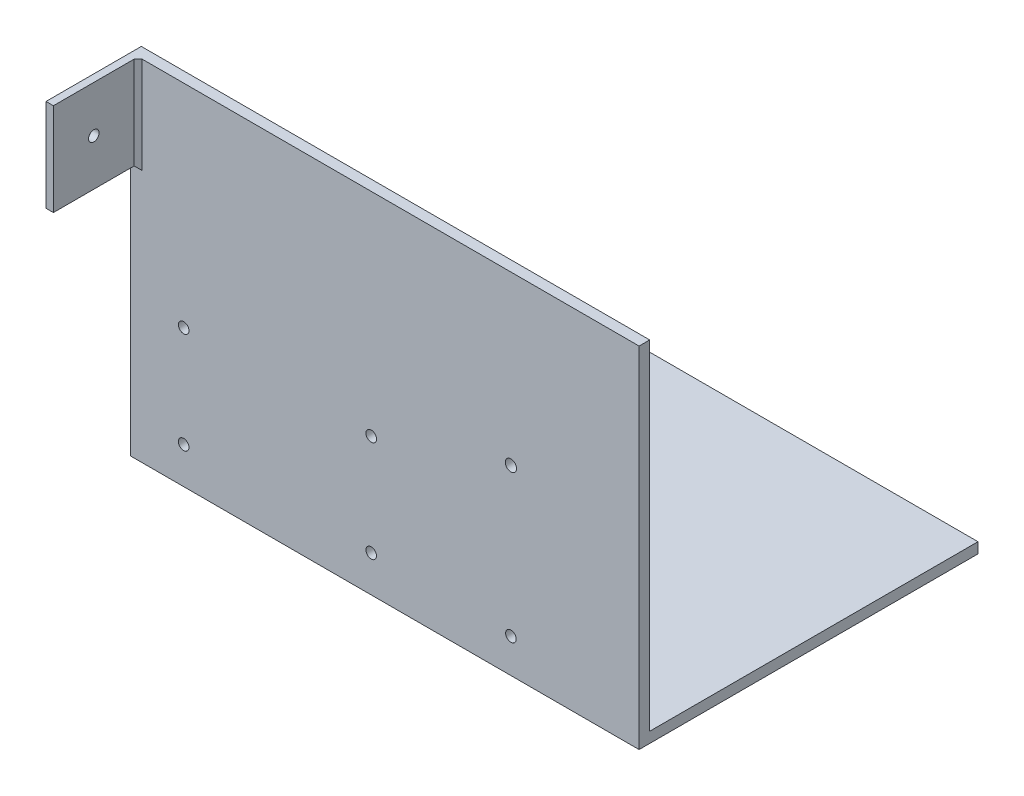
from build123d import *

# Parameters (mm, degrees)
SKETCH1_W           = 304.8
SKETCH1_H           = 203.2
BOSS_EXTRUDE1_DEPTH = 6.35
SKETCH2_W           = 304.8
SKETCH2_H           = 6.35
BOSS_EXTRUDE2_DEPTH = 40.64
SKETCH3_W           = 20.403275231
SKETCH3_H           = 40.64
CUT_EXTRUDE1_DEPTH  = 325.70549749
SKETCH2_2_W         = 304.8
SKETCH2_2_H         = 6.35
BOSS_EXTRUDE3_DEPTH = 203.2
SKETCH9_R           = 3.175
CUT_EXTRUDE2_DEPTH  = 10.922
SKETCH10_R          = 3.175
SKETCH10_R_2        = 3.392842108
CUT_EXTRUDE3_DEPTH  = 10.922
SKETCH11_W          = 4.440800547
SKETCH11_H          = 55.485459727
BOSS_EXTRUDE7_DEPTH = 50.8
CHAMFER1_SIZE       = 2.38
SKETCH12_W          = 5.089607789
SKETCH12_H          = 51.20183316
BOSS_EXTRUDE8_DEPTH = 50.8
CHAMFER2_SIZE       = 2.38
SKETCH13_R          = 3.175
CUT_EXTRUDE4_DEPTH  = 50.8
SKETCH14_R          = 3.175
CUT_EXTRUDE5_DEPTH  = 50.8


with BuildPart() as part:
    # Sketch1 → Boss-Extrude1 (new body)
    with BuildSketch(Plane(origin=(0, 0, 0), x_dir=(1, 0, 0), z_dir=(0, 1, 0))):
        Rectangle(SKETCH1_W, SKETCH1_H)
    extrude(amount=BOSS_EXTRUDE1_DEPTH)

    # Sketch2 → Boss-Extrude2 (add)
    with BuildSketch(Plane(origin=(0, 6.35, 0), x_dir=(1, 0, 0), z_dir=(0, 1, 0))):
        with Locations((0, -98.425)):
            Rectangle(SKETCH2_W, SKETCH2_H)
    extrude(amount=BOSS_EXTRUDE2_DEPTH)

    # Sketch3 → Cut-Extrude1 (cut, through all)
    with BuildSketch(Plane(origin=(152.4, 0, 0), x_dir=(0, 0, -1), z_dir=(1, 0, 0))):
        with Locations((-91.398362385, 26.67)):
            Rectangle(SKETCH3_W, SKETCH3_H)
        with Locations((91.398362385, 26.67)):
            Rectangle(SKETCH3_W, SKETCH3_H)
    extrude(amount=-CUT_EXTRUDE1_DEPTH, mode=Mode.SUBTRACT)

    # Sketch2<2> → Boss-Extrude3 (add)
    with BuildSketch(Plane(origin=(0, 6.35, 0), x_dir=(1, 0, 0), z_dir=(0, 1, 0))):
        with Locations((0, -98.425)):
            Rectangle(SKETCH2_2_W, SKETCH2_2_H)
    extrude(amount=BOSS_EXTRUDE3_DEPTH)

    # Sketch9 → Cut-Extrude2 (cut)
    with BuildSketch(Plane.XZ):
        with Locations((-120.65, 79.078648077)):
            Circle(SKETCH9_R)
        with Locations((-120.65, 18.102975355)):
            Circle(SKETCH9_R)
        with Locations((-8.205, 79.078648077)):
            Circle(SKETCH9_R)
        with Locations((-8.205, 18.102975355)):
            Circle(SKETCH9_R)
        with Locations((75.547873201, 73.627514031)):
            Circle(SKETCH9_R)
    extrude(amount=-CUT_EXTRUDE2_DEPTH, mode=Mode.SUBTRACT)

    # Sketch10 → Cut-Extrude3 (cut)
    with BuildSketch(Plane.XY.offset(101.6)):
        with Locations((-120.65, 82.55)):
            Circle(SKETCH10_R)
        with Locations((-120.65, 21.89944615)):
            Circle(SKETCH10_R)
        with Locations((-8.205, 82.46463474)):
            Circle(SKETCH10_R)
        with Locations((-8.205, 21.81408089)):
            Circle(SKETCH10_R)
        with Locations((75.547873201, 109.138715406)):
            Circle(SKETCH10_R_2)
        with Locations((75.547873201, 20.470285647)):
            Circle(SKETCH10_R)
    extrude(amount=-CUT_EXTRUDE3_DEPTH, mode=Mode.SUBTRACT)

    # Sketch11 → Boss-Extrude7 (add)
    with BuildSketch(Plane.XY.offset(101.6)):
        with Locations((-150.179599726, 181.807270136)):
            Rectangle(SKETCH11_W, SKETCH11_H)
    extrude(amount=BOSS_EXTRUDE7_DEPTH)

    # Chamfer1
    chamfer1_edges = [part.edges().sort_by_distance(p)[0] for p in [
        (-147.959199453, 181.807270136, 101.6),
        (-150.179599726, 154.064540273, 101.6),
    ]]
    chamfer(chamfer1_edges, length=CHAMFER1_SIZE)

    # Sketch12 → Boss-Extrude8 (add)
    with BuildSketch(Plane.XZ):
        with Locations((-149.855196105, -75.99908342)):
            Rectangle(SKETCH12_W, SKETCH12_H)
    extrude(amount=BOSS_EXTRUDE8_DEPTH)

    # Chamfer2
    chamfer2_edges = [part.edges().sort_by_distance(p)[0] for p in [
        (-149.855196105, 0, -50.39816684),
        (-147.310392211, 0, -75.99908342),
    ]]
    chamfer(chamfer2_edges, length=CHAMFER2_SIZE)

    # Sketch13 → Cut-Extrude4 (cut)
    with BuildSketch(Plane(origin=(-147.310392211, 0, 0), x_dir=(0, 0, -1), z_dir=(1, 0, 0))):
        with Locations((75.99908342, -26.59)):
            Circle(SKETCH13_R)
    extrude(amount=-CUT_EXTRUDE4_DEPTH, mode=Mode.SUBTRACT)

    # Sketch14 → Cut-Extrude5 (cut)
    with BuildSketch(Plane(origin=(-147.959199453, 0, 0), x_dir=(0, 0, -1), z_dir=(1, 0, 0))):
        with Locations((-128.19, 181.807270136)):
            Circle(SKETCH14_R)
    extrude(amount=-CUT_EXTRUDE5_DEPTH, mode=Mode.SUBTRACT)


solid = part.part
